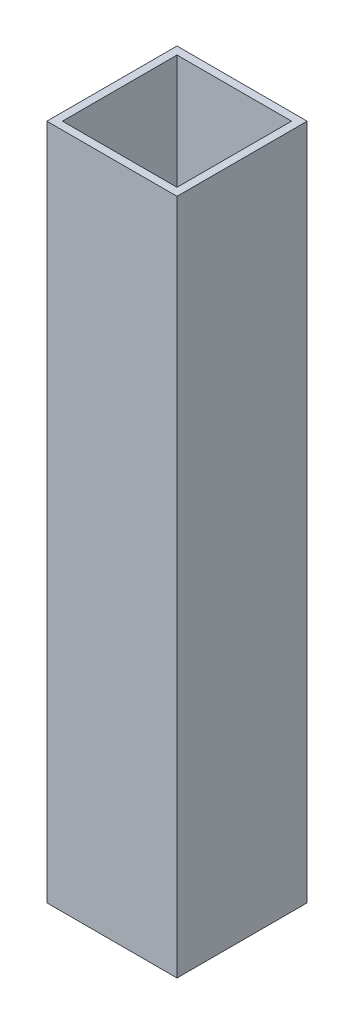
from build123d import *

# Parameters (mm, degrees)
BOSS_EXTRUDE1_DEPTH      = 65
BOSS_EXTRUDE1_DEPTH_BACK = 65
SKETCH1_W                = 25
SKETCH1_H                = 25
SKETCH1_W_2              = 22
SKETCH1_H_2              = 22


with BuildPart() as part:
    # Sketch1 → Boss-Extrude1 (new, two sides: drawn at the far end of the back side and taken through both)
    with BuildSketch(Plane(origin=(0, 0, 0), x_dir=(1, 0, 0), z_dir=(0, 1, 0)).offset(-BOSS_EXTRUDE1_DEPTH_BACK)):
        Rectangle(SKETCH1_W, SKETCH1_H)
        Rectangle(SKETCH1_W_2, SKETCH1_H_2, mode=Mode.SUBTRACT)
    extrude(amount=BOSS_EXTRUDE1_DEPTH + BOSS_EXTRUDE1_DEPTH_BACK)


solid = part.part
